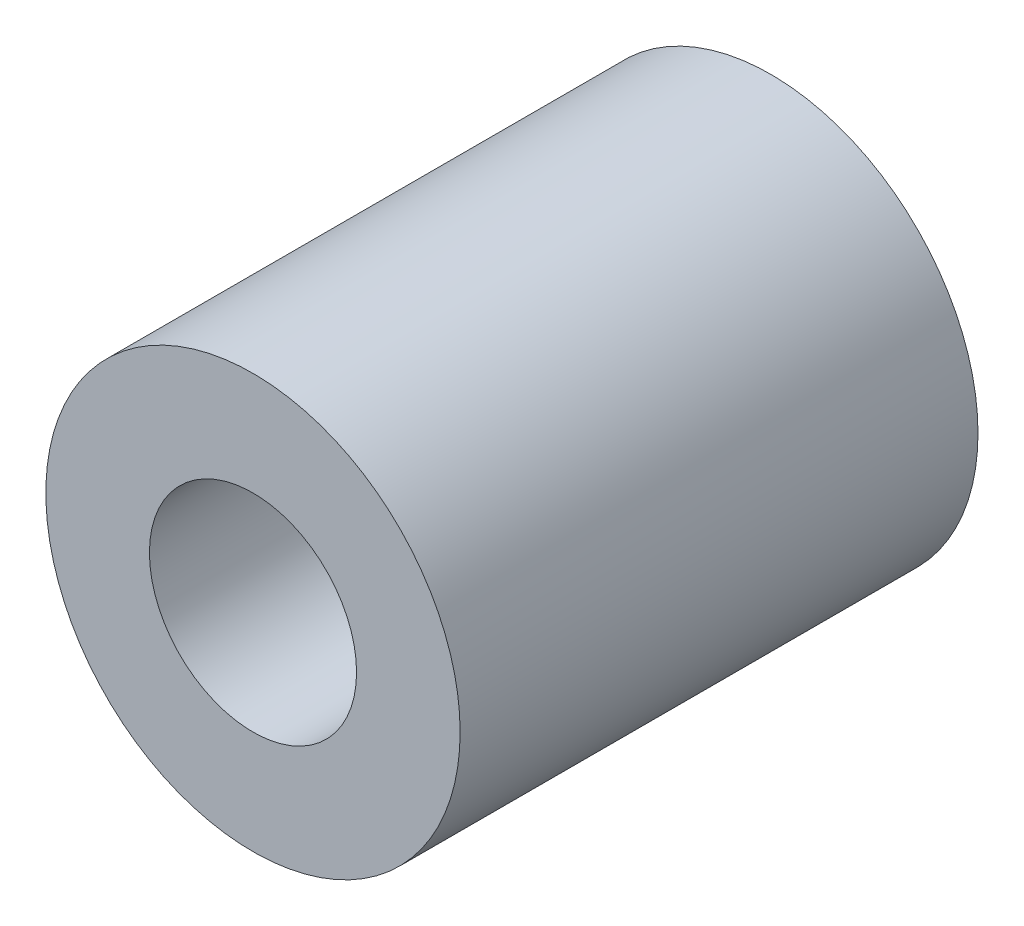
from build123d import *

# Parameters (mm, degrees)
SKETCH_1_R          = 10
SKETCH_1_R_2        = 4
EXTRUDE_1_DEPTH     = 25
SKETCH_2_R          = 5
CUT_EXTRUDE_1_DEPTH = 12.5


with BuildPart() as part:
    # 草图1 → 凸台-拉伸1 (new body)
    with BuildSketch(Plane.XY):
        Circle(SKETCH_1_R)
        Circle(SKETCH_1_R_2, mode=Mode.SUBTRACT)
    extrude(amount=EXTRUDE_1_DEPTH)

    # 草图2 → 切除-拉伸1 (cut)
    with BuildSketch(Plane.XY.offset(25)):
        Circle(SKETCH_2_R)
    extrude(amount=-CUT_EXTRUDE_1_DEPTH, mode=Mode.SUBTRACT)


solid = part.part
